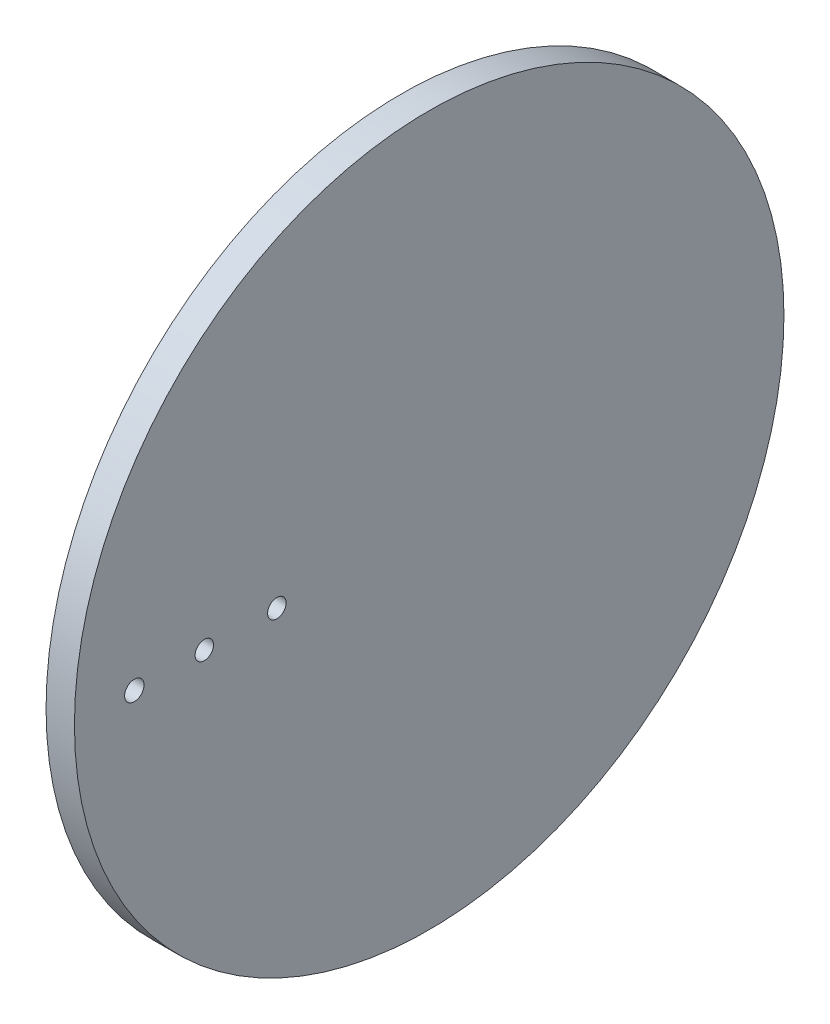
from build123d import *

# Parameters (mm, degrees)
CROQUIS1_R              = 37.5
SALIENTE_EXTRUIR1_DEPTH = 3
CROQUIS2_R              = 32.482230575
CROQUIS2_R_2            = 29.959502021
CROQUIS2_R_3            = 24.997270629
CROQUIS2_R_4            = 22.495570161
CROQUIS2_R_5            = 17.467972247
CROQUIS2_R_6            = 14.95820612
CORTAR_EXTRUIR1_DEPTH   = 1
CROQUIS3_R              = 0.976738779
CROQUIS3_R_2            = 0.973277505
CROQUIS3_R_3            = 1.026895089
CORTAR_EXTRUIR2_DEPTH   = 3


with BuildPart() as part:
    # Croquis1 → Saliente-Extruir1 (new body)
    with BuildSketch(Plane(origin=(0, 0, 0), x_dir=(0, 0, -1), z_dir=(1, 0, 0))):
        Circle(CROQUIS1_R)
    extrude(amount=SALIENTE_EXTRUIR1_DEPTH)

    # Croquis2 → Cortar-Extruir1 (cut)
    # profile 1 of 3: a face of its own
    with BuildSketch(Plane.ZY):
        Circle(CROQUIS2_R)
        Circle(CROQUIS2_R_2, mode=Mode.SUBTRACT)
    # profile 2 of 3: a face of its own
    with BuildSketch(Plane.ZY):
        Circle(CROQUIS2_R_3)
        Circle(CROQUIS2_R_4, mode=Mode.SUBTRACT)
    # profile 3 of 3: a face of its own
    with BuildSketch(Plane.ZY):
        Circle(CROQUIS2_R_5)
        Circle(CROQUIS2_R_6, mode=Mode.SUBTRACT)
    extrude(amount=-CORTAR_EXTRUIR1_DEPTH, mode=Mode.SUBTRACT)

    # Croquis3 → Cortar-Extruir2 (cut)
    with BuildSketch(Plane.ZY):
        with Locations((16.101684192, 0)):
            Circle(CROQUIS3_R)
        with Locations((23.768998706, 0)):
            Circle(CROQUIS3_R_2)
        with Locations((31.1682253, 0)):
            Circle(CROQUIS3_R_3)
    extrude(amount=-CORTAR_EXTRUIR2_DEPTH, mode=Mode.SUBTRACT)


solid = part.part
